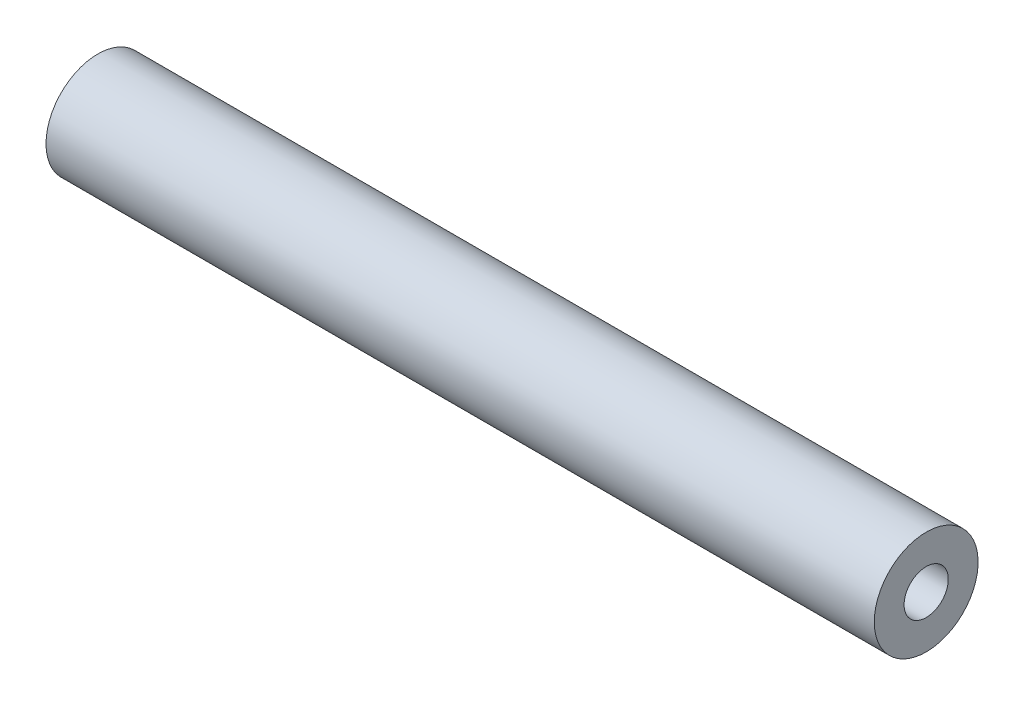
from build123d import *

# Parameters (mm, degrees)
SKETCH1_W = 19.05
SKETCH1_H = 0.6858


with BuildPart() as part:
    # Sketch1 → Revolve1 (revolve)
    with BuildSketch(Plane(origin=(0, 0, 0), x_dir=(1, 0, 0), z_dir=(0, 1, 0)), mode=Mode.PRIVATE) as revolve1_sk:
        with Locations((9.525, 0.8509)):
            Rectangle(SKETCH1_W, SKETCH1_H)
    revolve(revolve1_sk.sketch.rotate(Axis((0, 0, 0), (1, 0, 0)), 180), axis=Axis((0, 0, 0), (1, 0, 0)))


solid = part.part
